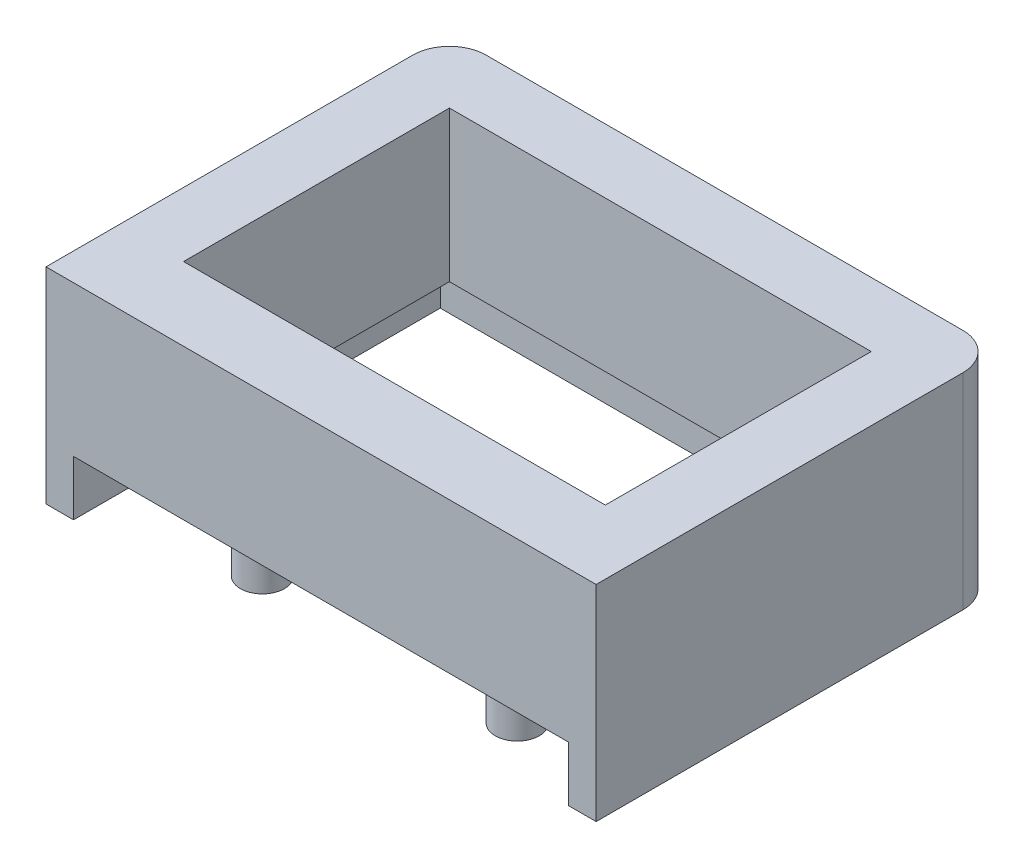
from build123d import *

# Parameters (mm, degrees)
RESSALTO_EXTRUS_O1_DEPTH = 4
RESSALTO_EXTRUS_O2_DEPTH = 4
ESBO_O2_W                = 30
ESBO_O2_H                = 4
RESSALTO_EXTRUS_O3_DEPTH = 5
RESSALTO_EXTRUS_O4_DEPTH = 5
ESBO_O5_W                = 22
ESBO_O5_H                = 1
CORTE_EXTRUS_O2_DEPTH    = 35
CORTE_EXTRUS_O3_DEPTH    = 10
ESBO_O9_W                = 23
ESBO_O9_H                = 14.5
RESSALTO_EXTRUS_O5_DEPTH = 3.2
ESBO_O4_W                = 0.5
ESBO_O4_H                = 20
CORTE_EXTRUS_O4_DEPTH    = 4
ESBO_O11_R               = 1.5
ESBO_O12_R               = 1.3
ESBO_O11_4_R             = 1.5
ESBO_O12_4_R             = 1.3


with BuildPart() as part:
    # Esboço1 → Ressalto-extrusão1 (new body)
    with BuildSketch(Plane(origin=(0, 0, 0), x_dir=(1, 0, 0), z_dir=(0, 1, 0))):
        with BuildLine():
            ThreePointArc((-4.5, -7.5), (-5.7, -6.3), (-6.9, -7.5))
            Line((-6.9, -7.5), (-5.7, -7.5))
            Line((-5.7, -7.5), (-4.5, -7.5))
        make_face()
        with BuildLine():
            Line((-5.7, -7.5), (-6.9, -7.5))
            ThreePointArc((-6.9, -7.5), (-5.7, -8.7), (-4.5, -7.5))
            Line((-4.5, -7.5), (-5.7, -7.5))
        make_face()
        with BuildLine():
            ThreePointArc((7, -7.5), (8.2, -8.7), (9.4, -7.5))
            Line((9.4, -7.5), (8.2, -7.5))
            Line((8.2, -7.5), (7, -7.5))
        make_face()
        with BuildLine():
            Line((8.2, -7.5), (9.4, -7.5))
            ThreePointArc((9.4, -7.5), (8.2, -6.3), (7, -7.5))
            Line((7, -7.5), (8.2, -7.5))
        make_face()
    extrude(amount=RESSALTO_EXTRUS_O1_DEPTH)



with BuildPart() as body_2:
    # Esboço1<3> → Ressalto-extrusão2 (new body)
    with BuildSketch(Plane(origin=(0, 0, 0), x_dir=(1, 0, 0), z_dir=(0, 1, 0))):
        Polygon((-13, -10), (-13, -9), (-13, -7.5), (-13, 10), (-11.5, 10), (13, 10), (13, -7.5), (13, -9), (13, -10), (15, -10), (15, 10), (15, 12), (13, 12), (-13, 12), (-15, 12), (-15, 10), (-15, -10), align=None)
    extrude(amount=RESSALTO_EXTRUS_O2_DEPTH)


with BuildPart() as part_1:
    add(part.part)

    add(body_2.part)  # Ressalto-extrusão3 merges body 2
    # Esboço2 → Ressalto-extrusão3 (add)
    with BuildSketch(Plane(origin=(0, 4, 0), x_dir=(1, 0, 0), z_dir=(0, 1, 0))):
        with Locations((0, -8)):
            Rectangle(ESBO_O2_W, ESBO_O2_H)
    extrude(amount=RESSALTO_EXTRUS_O3_DEPTH)

    # Esboço3 → Ressalto-extrusão4 (add)
    with BuildSketch(Plane(origin=(0, 4, 0), x_dir=(1, 0, 0), z_dir=(0, 1, 0))):
        Polygon((-11.5, 8.5), (11.5, 8.5), (11.5, -6), (13, -6), (13, 10), (-13, 10), (-13, -6), (-11.5, -6), align=None)
        Polygon((13, 10), (13, -6), (15, -6), (15, 12), (-15, 12), (-15, -6), (-13, -6), (-13, 10), align=None)
    extrude(amount=RESSALTO_EXTRUS_O4_DEPTH)

    # Esboço5 → Corte-extrusão2 (cut)
    with BuildSketch(Plane.ZY.offset(15)):
        with Locations((-1, 0.5)):
            Rectangle(ESBO_O5_W, ESBO_O5_H)
    extrude(amount=-CORTE_EXTRUS_O2_DEPTH, mode=Mode.SUBTRACT)

    # Esboço8 → Corte-extrusão3 (cut)
    with BuildSketch(Plane.XZ.offset(-1)):
        with BuildLine():
            Line((-15, -12), (-13, -12))
            ThreePointArc((-13, -12), (-14.414213562, -11.414213562), (-15, -10))
            Line((-15, -10), (-15, -12))
        make_face()
        with BuildLine():
            ThreePointArc((15, -10), (14.414213562, -11.414213562), (13, -12))
            Line((13, -12), (15, -12))
            Line((15, -12), (15, -10))
        make_face()
    extrude(amount=-CORTE_EXTRUS_O3_DEPTH, mode=Mode.SUBTRACT)

    # Esboço9 → Ressalto-extrusão5 (add)
    with BuildSketch(Plane(origin=(0, 9, 0), x_dir=(1, 0, 0), z_dir=(0, 1, 0))):
        with BuildLine():
            Line((13, 12), (-13, 12))
            ThreePointArc((-13, 12), (-14.414213562, 11.414213562), (-15, 10))
            Line((-15, 10), (-15, -10))
            Line((-15, -10), (15, -10))
            Line((15, -10), (15, 10))
            ThreePointArc((15, 10), (14.414213562, 11.414213562), (13, 12))
        make_face()
        with Locations((0, 1.25)):
            Rectangle(ESBO_O9_W, ESBO_O9_H, mode=Mode.SUBTRACT)
    extrude(amount=RESSALTO_EXTRUS_O5_DEPTH)

    # Esboço4 → Corte-extrusão4 (cut)
    with BuildSketch(Plane.XZ):
        with Locations((-13.25, 0)):
            Rectangle(ESBO_O4_W, ESBO_O4_H)
        with Locations((13.25, 0)):
            Rectangle(ESBO_O4_W, ESBO_O4_H)
    extrude(amount=-CORTE_EXTRUS_O4_DEPTH, mode=Mode.SUBTRACT)

    # Esboço11 → Loft4 section 0
    with BuildSketch(Plane.XZ.offset(-4)):
        with Locations((-5.7, 7.5)):
            Circle(ESBO_O11_R)
    # Esboço12 → Loft4 section 1
    with BuildSketch(Plane(origin=(0, 3, 0), x_dir=(-1, 0, 0), z_dir=(0, -1, 0))):
        with Locations((5.7, -7.5)):
            Circle(ESBO_O12_R)
    loft()

    # Esboço11<4> → Loft5 section 0
    with BuildSketch(Plane.XZ.offset(-4)):
        with Locations((8.2, 7.5)):
            Circle(ESBO_O11_4_R)
    # Esboço12<4> → Loft5 section 1
    with BuildSketch(Plane(origin=(0, 3, 0), x_dir=(-1, 0, 0), z_dir=(0, -1, 0))):
        with Locations((-8.2, -7.5)):
            Circle(ESBO_O12_4_R)
    loft()


solid = part_1.part
